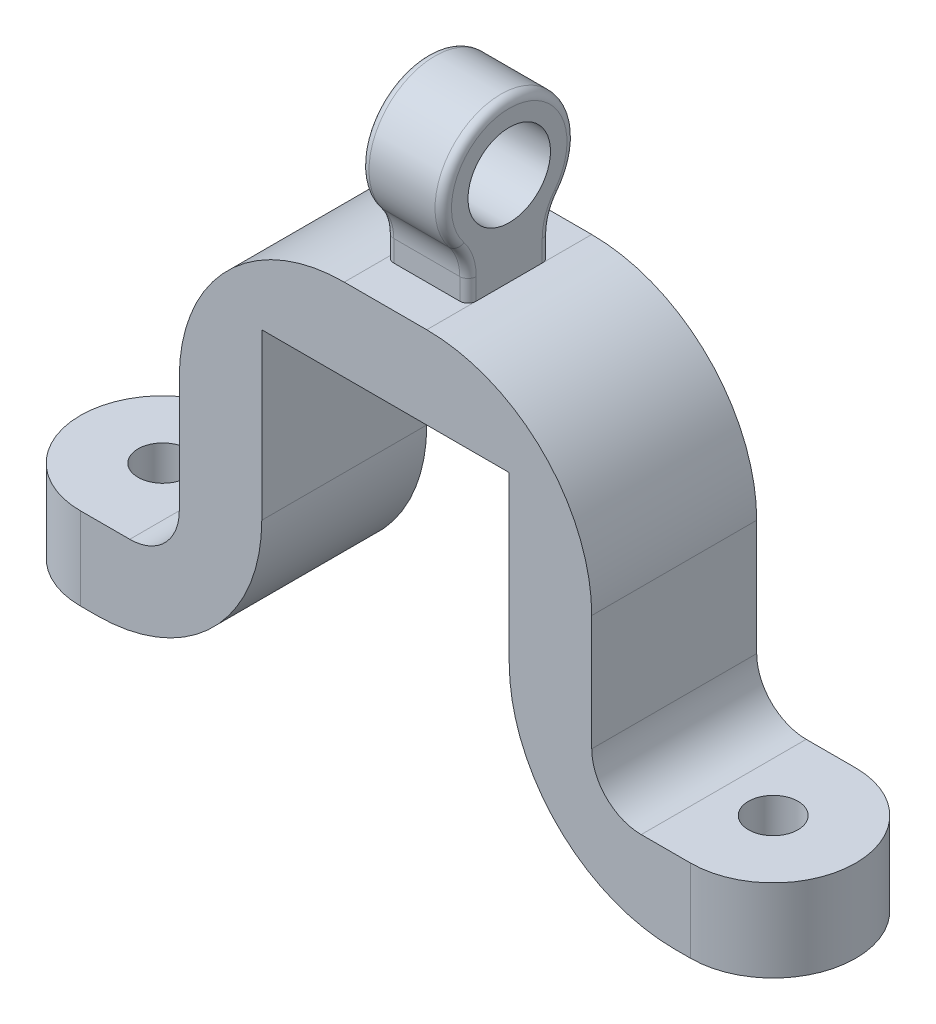
from build123d import *

# Parameters (mm, degrees)
BOSS_EXTRU_1_DEPTH      = 10
CONG_1_RADIUS           = 5
CONG_1_LENGTH           = 5
CONG_2_RADIUS           = 5
CONG_2_LENGTH           = 5
CONG_3_R                = 10
CONG_4_R                = 10
CONG_6_R                = 3
CONG_7_R                = 3
ESQUISSE2_R             = 1.5
ENL_V_MAT_EXTRU_1_DEPTH = 10
BOSS_EXTRU_2_START      = 21
ESQUISSE3_W             = 5
ESQUISSE3_H             = 2.5
BOSS_EXTRU_2_DEPTH      = 5
ESQUISSE5_R             = 2.5
BOSS_EXTRU_3_DEPTH      = 5
CONG_8_R                = 3
CONG_9_R                = 3
CONG_14_R               = 0.5


with BuildPart() as part:
    # Esquisse1 → Boss.-Extru.1 (new body)
    with BuildSketch(Plane.XY):
        Polygon((0, 0), (16, 0), (16, 20), (31, 20), (31, 0), (47, 0), (47, 5), (36, 5), (36, 25), (11, 25), (11, 5), (0, 5), align=None)
    extrude(amount=BOSS_EXTRU_1_DEPTH)

    # Congé1: full round fillet: the end face becomes a half cylinder, R = half its width
    cong_1_face = Plane((0, 2.5, 5), x_dir=(0, -1, 0), z_dir=(-1, 0, 0))  # on the end face: x along it, z out of the body
    cong_1_slab = cong_1_face.offset(-CONG_1_RADIUS / 2) * Box(CONG_1_LENGTH, 2 * CONG_1_RADIUS, CONG_1_RADIUS, mode=Mode.PRIVATE)  # the body's end, R deep
    cong_1_round = Plane((5, 2.5, 5), x_dir=(-1, 0, 0), z_dir=(0, -1, 0)) * Cylinder(CONG_1_RADIUS, CONG_1_LENGTH, mode=Mode.PRIVATE)  # its axis R under the face
    add(cong_1_slab - cong_1_round, mode=Mode.SUBTRACT)

    # Congé2: full round fillet: the end face becomes a half cylinder, R = half its width
    cong_2_face = Plane((47, 2.5, 5), x_dir=(0, 1, 0), z_dir=(1, 0, 0))  # on the end face: x along it, z out of the body
    cong_2_slab = cong_2_face.offset(-CONG_2_RADIUS / 2) * Box(CONG_2_LENGTH, 2 * CONG_2_RADIUS, CONG_2_RADIUS, mode=Mode.PRIVATE)  # the body's end, R deep
    cong_2_round = Plane((42, 2.5, 5), x_dir=(1, 0, 0), z_dir=(0, 1, 0)) * Cylinder(CONG_2_RADIUS, CONG_2_LENGTH, mode=Mode.PRIVATE)  # its axis R under the face
    add(cong_2_slab - cong_2_round, mode=Mode.SUBTRACT)

    # Congé3
    cong_3_edges = [part.edges().sort_by_distance(p)[0] for p in [
        (31, 0, 5),
        (16, 0, 5),
    ]]
    fillet(cong_3_edges, radius=CONG_3_R)

    # Congé4
    cong_4_edges = [part.edges().sort_by_distance(p)[0] for p in [
        (11, 25, 5),
        (36, 25, 5),
    ]]
    fillet(cong_4_edges, radius=CONG_4_R)

    # Congé6
    cong_6_edges = [part.edges().sort_by_distance(p)[0] for p in [
        (11, 5, 5),
    ]]
    fillet(cong_6_edges, radius=CONG_6_R)

    # Congé7
    cong_7_edges = [part.edges().sort_by_distance(p)[0] for p in [
        (36, 5, 5),
    ]]
    fillet(cong_7_edges, radius=CONG_7_R)

    # Esquisse2 → Enlèv. mat.-Extru.1 (cut)
    with BuildSketch(Plane(origin=(0, 5, 0), x_dir=(1, 0, 0), z_dir=(0, 1, 0))):
        with Locations(Location((5, -5, 0), (0, 0, 270))):
            Circle(ESQUISSE2_R)
        with Locations(Location((42, -5, 0), (0, 0, 270))):
            Circle(ESQUISSE2_R)
    extrude(amount=-ENL_V_MAT_EXTRU_1_DEPTH, mode=Mode.SUBTRACT)

    # Esquisse3 → Boss.-Extru.2 (add)
    with BuildSketch(Plane(origin=(0, 0, 0), x_dir=(0, 0, -1), z_dir=(1, 0, 0)).offset(BOSS_EXTRU_2_START)):
        with Locations((-5, 26.25)):
            Rectangle(ESQUISSE3_W, ESQUISSE3_H)
    extrude(amount=BOSS_EXTRU_2_DEPTH)

    # Esquisse5 → Boss.-Extru.3 (add)
    with BuildSketch(Plane(origin=(26, 0, 0), x_dir=(0, 0, -1), z_dir=(1, 0, 0))):
        with BuildLine():
            Line((-7.5, 27.5), (-2.5, 27.5))
            ThreePointArc((-2.5, 27.5), (-5, 34.622498999), (-7.5, 27.5))
        make_face()
        with Locations((-5, 30.622498999)):
            Circle(ESQUISSE5_R, mode=Mode.SUBTRACT)
    extrude(amount=-BOSS_EXTRU_3_DEPTH)

    # Congé8
    cong_8_edges = [part.edges().sort_by_distance(p)[0] for p in [
        (23.5, 27.5, 7.5),
    ]]
    fillet(cong_8_edges, radius=CONG_8_R)

    # Congé9
    cong_9_edges = [part.edges().sort_by_distance(p)[0] for p in [
        (23.5, 27.5, 2.5),
    ]]
    fillet(cong_9_edges, radius=CONG_9_R)

    # Congé14
    cong_14_edges = [part.edges().sort_by_distance(p)[0] for p in [
        (21, 25.64618599, 2.5),
        (26, 25.64618599, 2.5),
        (21, 25.64618599, 7.5),
        (26, 25.64618599, 7.5),
        (26, 27.274352486, 7.665266452),
        (21, 27.274352486, 7.665266452),
        (21, 34.622498999, 5),
        (26, 34.622498999, 5),
        (21, 27.274352486, 2.334733548),
        (26, 27.274352486, 2.334733548),
    ]]
    fillet(cong_14_edges, radius=CONG_14_R)


solid = part.part
